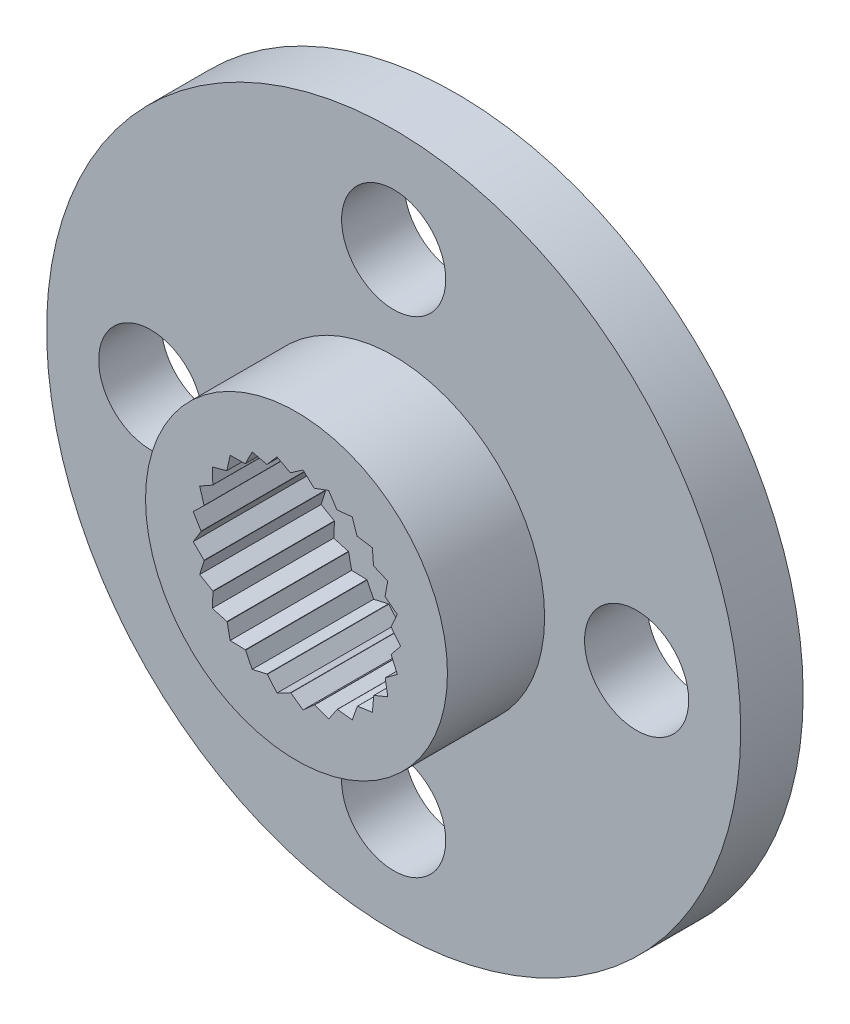
from build123d import *

# Parameters (mm, degrees)
SKETCH1_R           = 10
SKETCH1_R_2         = 1.5
SKETCH1_R_3         = 4.35
BOSS_EXTRUDE1_DEPTH = 1.8
SKETCH1_2_R         = 4.35
BOSS_EXTRUDE2_DEPTH = 4.6
SKETCH2_R           = 1.5
CUT_EXTRUDE1_DEPTH  = 4.5
SKETCH3_R           = 2.75
CUT_EXTRUDE2_DEPTH  = 3.5
CUT_EXTRUDE3_DEPTH  = 3.5
CIRPATTERN1_COUNT   = 25


with BuildPart() as part:
    # Sketch1 → Boss-Extrude1 (new body)
    with BuildSketch(Plane.XY):
        Circle(SKETCH1_R)
        with Locations((0, 7)):
            Circle(SKETCH1_R_2, mode=Mode.SUBTRACT)
        with Locations((7, 0)):
            Circle(SKETCH1_R_2, mode=Mode.SUBTRACT)
        with Locations((0, -7)):
            Circle(SKETCH1_R_2, mode=Mode.SUBTRACT)
        with Locations((-7, 0)):
            Circle(SKETCH1_R_2, mode=Mode.SUBTRACT)
        Circle(SKETCH1_R_3, mode=Mode.SUBTRACT)
    extrude(amount=BOSS_EXTRUDE1_DEPTH)

    # Sketch1<2> → Boss-Extrude2 (add)
    with BuildSketch(Plane.XY):
        Circle(SKETCH1_2_R)
    extrude(amount=BOSS_EXTRUDE2_DEPTH)

    # Sketch2 → Cut-Extrude1 (cut)
    with BuildSketch(Plane(origin=(0, 0, 0), x_dir=(-1, 0, 0), z_dir=(0, 0, -1))):
        Circle(SKETCH2_R)
    extrude(amount=-CUT_EXTRUDE1_DEPTH, mode=Mode.SUBTRACT)

    # Sketch3 → Cut-Extrude2 (cut)
    with BuildSketch(Plane.XY.offset(4.6)):
        Circle(SKETCH3_R)
    extrude(amount=-CUT_EXTRUDE2_DEPTH, mode=Mode.SUBTRACT)

    # Sketch4 → Cut-Extrude3 (cut)
    with BuildSketch(Plane.XY.offset(4.6)):
        with BuildLine():
            Line((-2.976344104, 0.375999701), (-2.75, 0))
            ThreePointArc((-2.75, 0), (-2.728912829, 0.339904061), (-2.665974712, 0.674595311))
            Line((-2.665974712, 0.674595311), (-2.976344104, 0.375999701))
        make_face()
    cut_extrude3 = extrude(amount=-CUT_EXTRUDE3_DEPTH, mode=Mode.SUBTRACT)

    # CirPattern1: Cut-Extrude3 ×25 about axis
    cirpattern1_axis = Axis((0, 0, 4.5), (0, 0, -1))
    for i in range(1, CIRPATTERN1_COUNT):
        add(cut_extrude3.rotate(cirpattern1_axis, i * 360 / CIRPATTERN1_COUNT), mode=Mode.SUBTRACT)


solid = part.part
